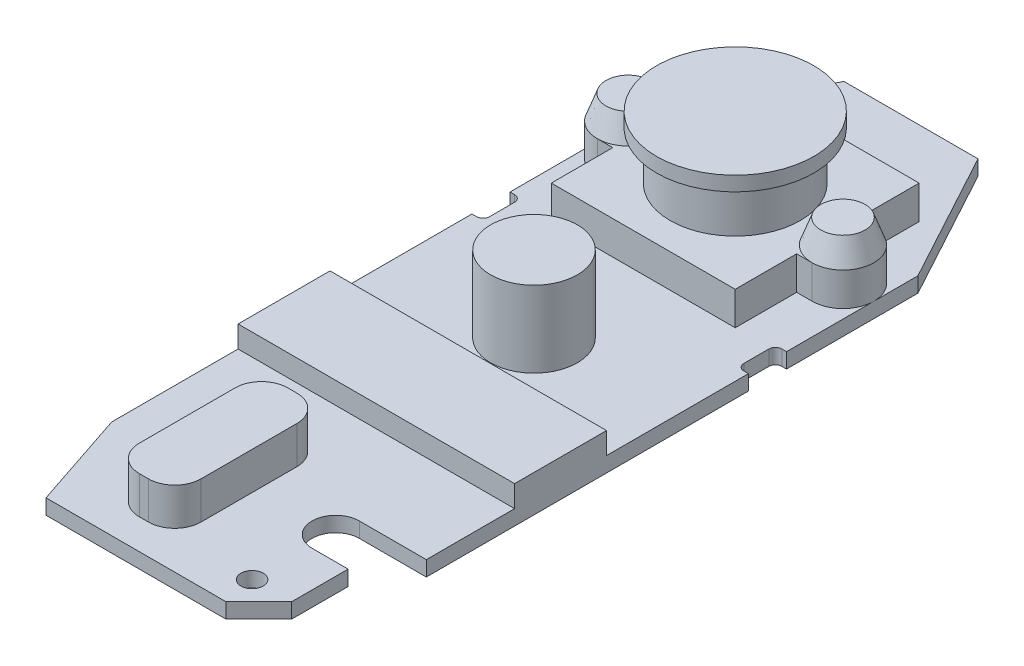
from build123d import *

# Parameters (mm, degrees)
SKETCH_1_R      = 0.85
EXTRUDE_1_DEPTH = 1.15
EXTRUDE_2_DEPTH = 2.54
SKETCH_3_R      = 4.95
EXTRUDE_3_DEPTH = 3.65
SKETCH_4_R      = 5.985
EXTRUDE_4_DEPTH = 1.1
SKETCH_5_R      = 2.35
EXTRUDE_5_DEPTH = 1.825
EXTRUDE_5_TAPER = 20
SKETCH_6_R      = 3.3
EXTRUDE_6_DEPTH = 5.8
SKETCH_7_W      = 21.05
SKETCH_7_H      = 7
EXTRUDE_7_DEPTH = 1.65
EXTRUDE_8_DEPTH = 2.85
SKETCH_9_W      = 6
SKETCH_9_H      = 4.3
EXTRUDE_9_DEPTH = 2.95


with BuildPart() as part:
    # Эскиз1 → Бобышка-Вытянуть1 (new body)
    with BuildSketch(Plane(origin=(0, 0, 0), x_dir=(1, 0, 0), z_dir=(0, 1, 0))):
        with BuildLine():
            Line((5.1, 17.801195131), (10.525, 7.801195131))
            Line((10.525, 7.801195131), (10.525, -2.198804869))
            Line((10.525, -2.198804869), (10.175, -2.198804869))
            ThreePointArc((10.175, -2.198804869), (9.821446609, -2.345251479), (9.675, -2.698804869))
            Line((9.675, -2.698804869), (9.675, -4.598804869))
            ThreePointArc((9.675, -4.598804869), (9.821446609, -4.95235826), (10.175, -5.098804869))
            Line((10.175, -5.098804869), (10.525, -5.098804869))
            Line((10.525, -5.098804869), (10.525, -29.618804869))
            Line((10.525, -29.618804869), (5.425, -29.618804869))
            ThreePointArc((5.425, -29.618804869), (3.625, -31.418804869), (5.425, -33.218804869))
            Line((5.425, -33.218804869), (8.175, -33.218804869))
            Line((8.175, -33.218804869), (8.175, -37.518804869))
            Line((8.175, -37.518804869), (5.675, -40.018804869))
            Line((5.675, -40.018804869), (-8.025, -40.018804869))
            Line((-8.025, -40.018804869), (-10.525, -32.518804869))
            Line((-10.525, -32.518804869), (-10.525, -5.098804869))
            Line((-10.525, -5.098804869), (-10.175, -5.098804869))
            ThreePointArc((-10.175, -5.098804869), (-9.821446609, -4.95235826), (-9.675, -4.598804869))
            Line((-9.675, -4.598804869), (-9.675, -2.698804869))
            ThreePointArc((-9.675, -2.698804869), (-9.821446609, -2.345251479), (-10.175, -2.198804869))
            Line((-10.175, -2.198804869), (-10.525, -2.198804869))
            Line((-10.525, -2.198804869), (-10.525, 7.801195131))
            Line((-10.525, 7.801195131), (-5.1, 17.801195131))
            Line((-5.1, 17.801195131), (5.1, 17.801195131))
        make_face()
        with Locations(Location((5.211720062, -37.568804869, 0), (0, 0, 270))):
            Circle(SKETCH_1_R, mode=Mode.SUBTRACT)
        with Locations(Location((-4.903634314, 13.801195131, 0), (0, 0, 270))):
            Circle(SKETCH_1_R, mode=Mode.SUBTRACT)
    extrude(amount=EXTRUDE_1_DEPTH)

    # Эскиз2 → Бобышка-Вытянуть2 (add)
    with BuildSketch(Plane(origin=(0, 1.15, 0), x_dir=(1, 0, 0), z_dir=(0, 1, 0))):
        with BuildLine():
            Line((-7, 11.421195131), (7, 11.421195131))
            Line((7, 11.421195131), (7, 6.797688136))
            Line((7, 6.797688136), (8.175, 6.797688136))
            ThreePointArc((8.175, 6.797688136), (10.525, 4.447688136), (8.175, 2.097688136))
            Line((8.175, 2.097688136), (7, 2.097688136))
            Line((7, 2.097688136), (7, -2.578804869))
            Line((7, -2.578804869), (-7, -2.578804869))
            Line((-7, -2.578804869), (-7, 2.097688136))
            Line((-7, 2.097688136), (-8.175, 2.097688136))
            ThreePointArc((-8.175, 2.097688136), (-10.525, 4.447688136), (-8.175, 6.797688136))
            Line((-8.175, 6.797688136), (-7, 6.797688136))
            Line((-7, 6.797688136), (-7, 11.421195131))
        make_face()
    extrude(amount=EXTRUDE_2_DEPTH)

    # Эскиз3 → Бобышка-Вытянуть3 (add)
    with BuildSketch(Plane(origin=(0, 3.69, 0), x_dir=(1, 0, 0), z_dir=(0, 1, 0))):
        with Locations(Location((0, 4.421195131, 0), (0, 0, 270))):
            Circle(SKETCH_3_R)
    extrude(amount=EXTRUDE_3_DEPTH)

    # Эскиз4 → Бобышка-Вытянуть4 (add)
    with BuildSketch(Plane(origin=(0, 7.34, 0), x_dir=(1, 0, 0), z_dir=(0, 1, 0))):
        with Locations(Location((0, 4.421195131, 0), (0, 0, 270))):
            Circle(SKETCH_4_R)
    extrude(amount=EXTRUDE_4_DEPTH)

    # Эскиз5 → Бобышка-Вытянуть5 (add)
    with BuildSketch(Plane(origin=(0, 3.69, 0), x_dir=(1, 0, 0), z_dir=(0, 1, 0))):
        with Locations((-8.175, 4.447688136)):
            Circle(SKETCH_5_R)
    extrude_5 = extrude(amount=EXTRUDE_5_DEPTH, taper=EXTRUDE_5_TAPER)

    # Зеркальное отражение1: Бобышка-Вытянуть5 across plane
    add(extrude_5.mirror(Plane(origin=(0, 0, 0), x_dir=(0, 0, 1), z_dir=(1, 0, 0))))

    # Эскиз6 → Бобышка-Вытянуть6 (add)
    with BuildSketch(Plane(origin=(0, 1.15, 0), x_dir=(1, 0, 0), z_dir=(0, 1, 0))):
        with Locations(Location((0, -10.898804869, 0), (0, 0, 270))):
            Circle(SKETCH_6_R)
    extrude(amount=EXTRUDE_6_DEPTH)

    # Эскиз7 → Бобышка-Вытянуть7 (add)
    with BuildSketch(Plane(origin=(0, 1.15, 0), x_dir=(1, 0, 0), z_dir=(0, 1, 0))):
        with Locations((0, -19.398804869)):
            Rectangle(SKETCH_7_W, SKETCH_7_H)
    extrude(amount=EXTRUDE_7_DEPTH)

    # Эскиз8 → Бобышка-Вытянуть8 (add)
    with BuildSketch(Plane(origin=(0, 1.15, 0), x_dir=(1, 0, 0), z_dir=(0, 1, 0))):
        with BuildLine():
            Line((-3.225, -26.418804869), (-2.525, -26.418804869))
            ThreePointArc((-2.525, -26.418804869), (-1.110786438, -27.004591307), (-0.525, -28.418804869))
            Line((-0.525, -28.418804869), (-0.525, -35.718804869))
            ThreePointArc((-0.525, -35.718804869), (-1.110786438, -37.133018432), (-2.525, -37.718804869))
            Line((-2.525, -37.718804869), (-3.225, -37.718804869))
            ThreePointArc((-3.225, -37.718804869), (-4.639213562, -37.133018432), (-5.225, -35.718804869))
            Line((-5.225, -35.718804869), (-5.225, -28.418804869))
            ThreePointArc((-5.225, -28.418804869), (-4.639213562, -27.004591307), (-3.225, -26.418804869))
        make_face()
    extrude(amount=EXTRUDE_8_DEPTH)

    # Эскиз9 → Бобышка-Вытянуть9 (add)
    with BuildSketch(Plane.XZ):
        with Locations((-5.975, 29.018804869)):
            Rectangle(SKETCH_9_W, SKETCH_9_H)
    extrude(amount=EXTRUDE_9_DEPTH)


solid = part.part
